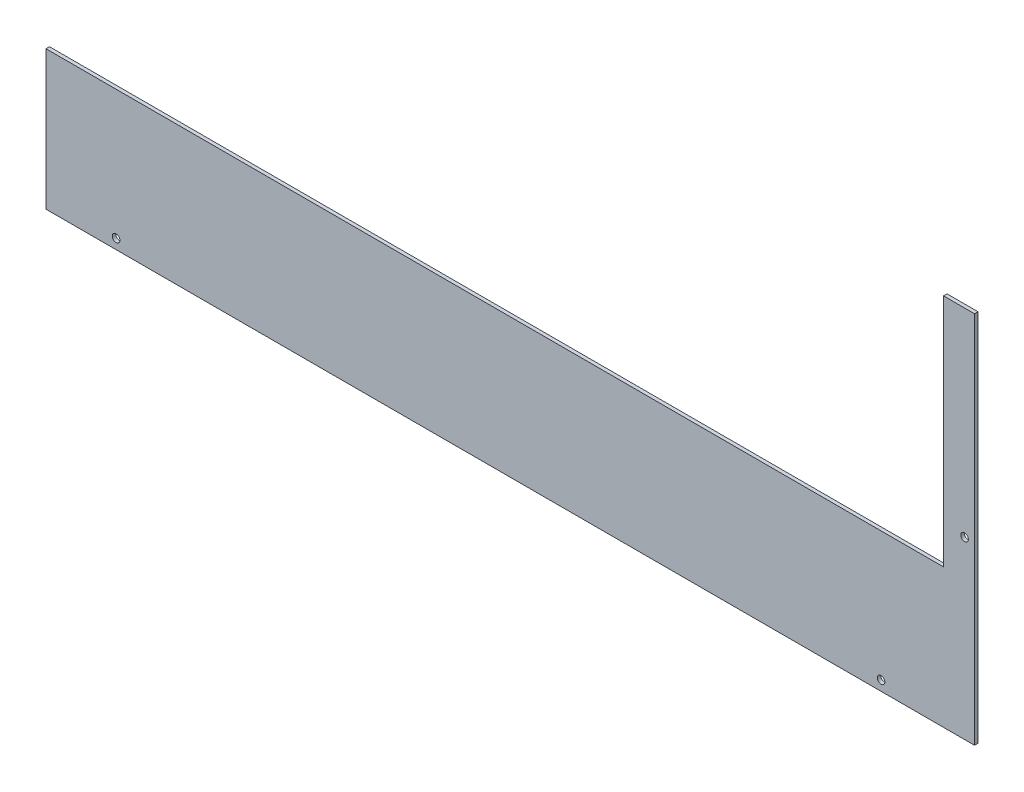
from build123d import *

# Parameters (mm, degrees)
SKETCH_1_R      = 3.25
EXTRUDE_1_DEPTH = 3


with BuildPart() as part:
    # 스케치1 → 보스-돌출1 (new body)
    with BuildSketch(Plane.XY):
        Polygon((0, 0), (795, 0), (795, 320), (768.5, 320), (768.5, 119), (0, 119), align=None)
        with Locations((60, 8.5)):
            Circle(SKETCH_1_R, mode=Mode.SUBTRACT)
        with Locations((715, 8.5)):
            Circle(SKETCH_1_R, mode=Mode.SUBTRACT)
        with Locations((786.5, 150)):
            Circle(SKETCH_1_R, mode=Mode.SUBTRACT)
    extrude(amount=EXTRUDE_1_DEPTH)


solid = part.part
